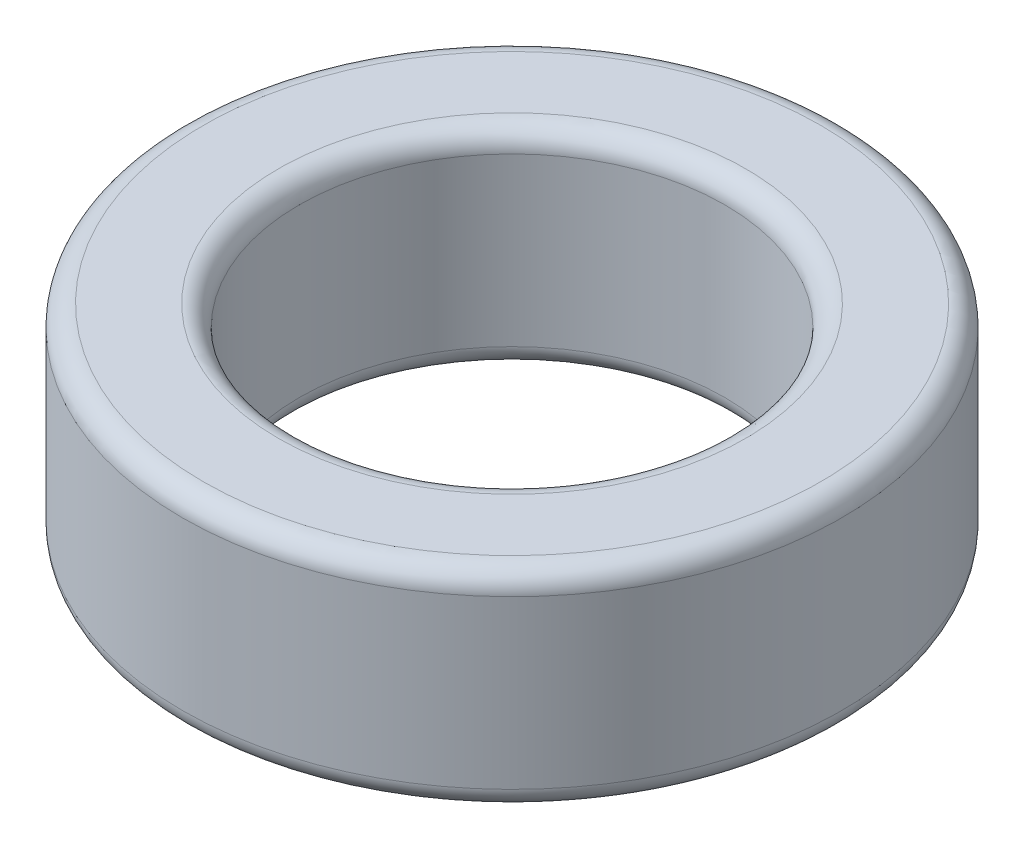
from build123d import *

# Parameters (mm, degrees)
SKETCH_1_R      = 7.9
SKETCH_1_R_2    = 5.1
EXTRUDE_1_DEPTH = 5
FILLET_1_R      = 0.5


with BuildPart() as part:
    # 草圖1 → 填料-伸長1 (new body)
    with BuildSketch(Plane(origin=(0, 0, 0), x_dir=(1, 0, 0), z_dir=(0, 1, 0))):
        with Locations(Location((0, 0, 0), (0, 0, 270))):
            Circle(SKETCH_1_R)
        with Locations(Location((0, 0, 0), (0, 0, 270))):
            Circle(SKETCH_1_R_2, mode=Mode.SUBTRACT)
    extrude(amount=EXTRUDE_1_DEPTH)

    # 圓角1
    fillet_1_edges = [part.edges().sort_by_distance(p)[0] for p in [
        (0, 0, -7.9),
        (0, 5, -7.9),
        (0, 0, -5.1),
        (0, 5, -5.1),
    ]]
    fillet(fillet_1_edges, radius=FILLET_1_R)


solid = part.part
